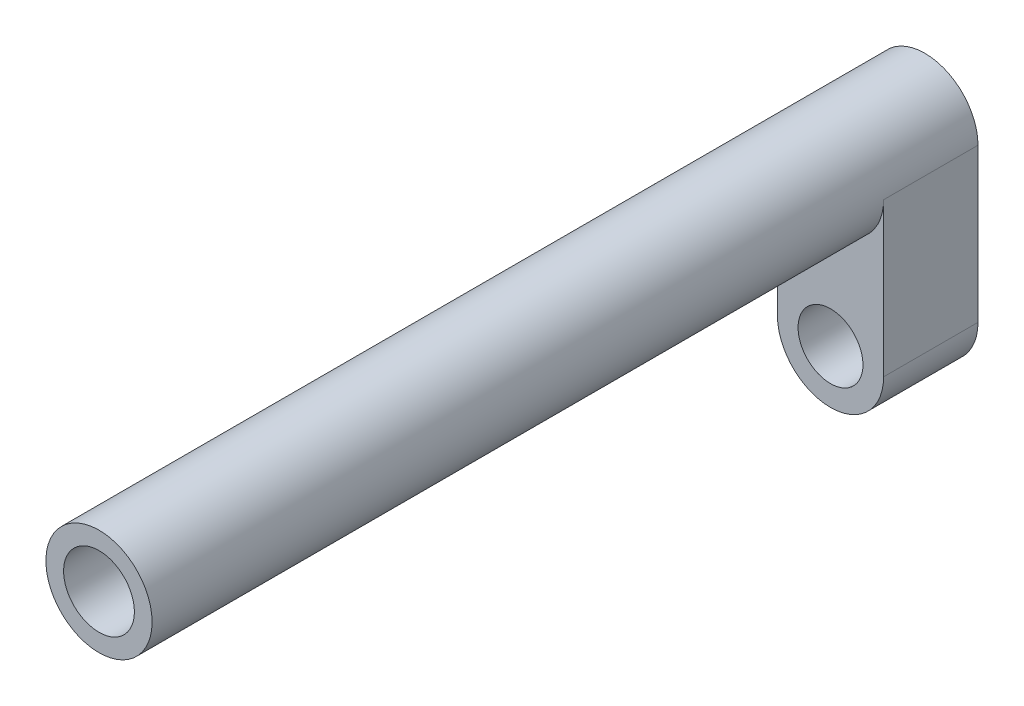
from build123d import *

# Parameters (mm, degrees)
SKETCH1_R           = 1.375
BOSS_EXTRUDE1_DEPTH = 4
SKETCH1_4_R         = 1.5
BOSS_EXTRUDE3_DEPTH = 35


with BuildPart() as part:
    # Sketch1 → Boss-Extrude1 (new body)
    with BuildSketch(Plane.XY):
        with BuildLine():
            Line((-2.25, 3.84870854), (-2.25, -2.65129146))
            ThreePointArc((-2.25, -2.65129146), (0, -4.90129146), (2.25, -2.65129146))
            Line((2.25, -2.65129146), (2.25, 3.84870854))
            ThreePointArc((2.25, 3.84870854), (0, 1.59870854), (-2.25, 3.84870854))
        make_face()
        with Locations((0, -2.65129146)):
            Circle(SKETCH1_R, mode=Mode.SUBTRACT)
    extrude(amount=BOSS_EXTRUDE1_DEPTH)

    # Sketch1<4> → Boss-Extrude3 (add)
    with BuildSketch(Plane.XY):
        with BuildLine():
            ThreePointArc((2.25, 3.84870854), (0, 6.09870854), (-2.25, 3.84870854))
            ThreePointArc((-2.25, 3.84870854), (0, 1.59870854), (2.25, 3.84870854))
        make_face()
        with Locations((0, 3.84870854)):
            Circle(SKETCH1_4_R, mode=Mode.SUBTRACT)
    extrude(amount=BOSS_EXTRUDE3_DEPTH)


solid = part.part
